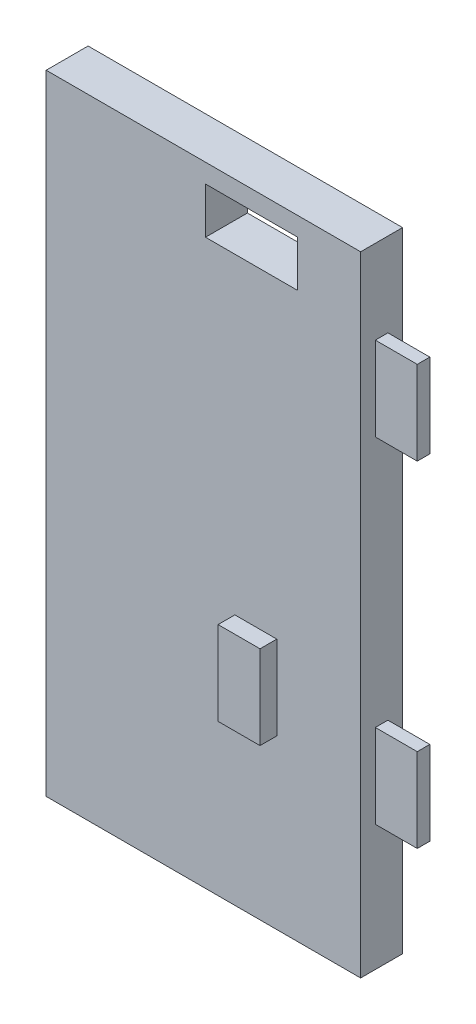
from build123d import *

# Parameters (mm, degrees)
SKETCH1_W           = 150
SKETCH1_H           = 75
SKETCH1_W_2         = 11
SKETCH1_H_2         = 22
BOSS_EXTRUDE1_DEPTH = 10
SKETCH2_W           = 10
SKETCH2_H           = 20
BOSS_EXTRUDE2_DEPTH = 4
SKETCH3_W           = 20
SKETCH3_H           = 3
BOSS_EXTRUDE3_DEPTH = 10
SKETCH4_W           = 20.5
SKETCH4_H           = 3.2
CUT_EXTRUDE1_DEPTH  = 10


with BuildPart() as part:
    # Sketch1 → Boss-Extrude1 (new body)
    with BuildSketch(Plane(origin=(0, 0, 0), x_dir=(0, 1, 0), z_dir=(0, 0, 1))):
        Rectangle(SKETCH1_W, SKETCH1_H)
        with Locations((65, -11.5)):
            Rectangle(SKETCH1_W_2, SKETCH1_H_2, mode=Mode.SUBTRACT)
    extrude(amount=BOSS_EXTRUDE1_DEPTH)

    # Sketch2 → Boss-Extrude2 (add)
    with BuildSketch(Plane.XY.offset(10)):
        with Locations((12.5, -25)):
            Rectangle(SKETCH2_W, SKETCH2_H)
    extrude(amount=BOSS_EXTRUDE2_DEPTH)

    # Sketch3 → Boss-Extrude3 (add)
    with BuildSketch(Plane.YZ.offset(37.5)):
        with Locations((45, 5)):
            Rectangle(SKETCH3_W, SKETCH3_H)
        with Locations((-35, 5)):
            Rectangle(SKETCH3_W, SKETCH3_H)
    extrude(amount=BOSS_EXTRUDE3_DEPTH)

    # Sketch4 → Cut-Extrude1 (cut)
    with BuildSketch(Plane.XZ.offset(75)):
        with Locations((0, 5)):
            Rectangle(SKETCH4_W, SKETCH4_H)
    extrude(amount=-CUT_EXTRUDE1_DEPTH, mode=Mode.SUBTRACT)


solid = part.part
